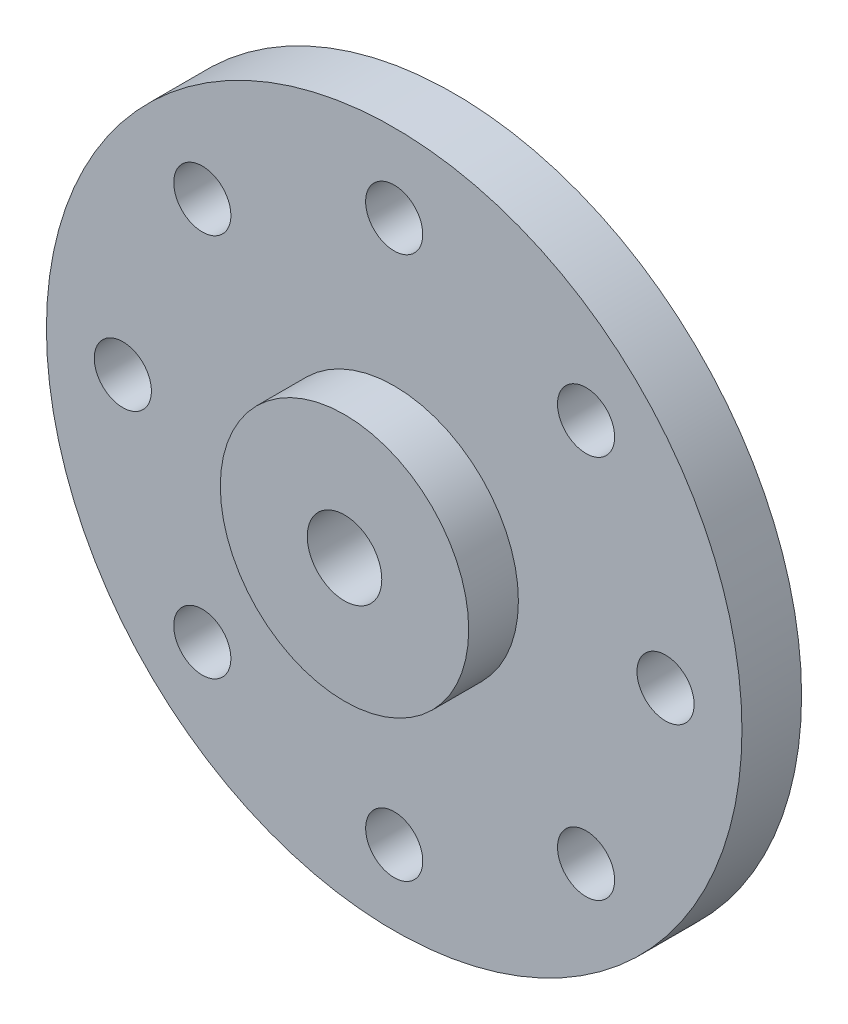
from build123d import *

# Parameters (mm, degrees)
SKETCH1_R           = 14
BOSS_EXTRUDE1_DEPTH = 2.4
SKETCH2_R           = 1.15
CUT_EXTRUDE1_DEPTH  = 20.94392138
CIRPATTERN2_COUNT   = 8
SKETCH4_R           = 5
BOSS_EXTRUDE2_DEPTH = 2
SKETCH5_R           = 1.5
CUT_EXTRUDE3_DEPTH  = 21.282011735


with BuildPart() as part:
    # Sketch1 → Boss-Extrude1 (new body)
    with BuildSketch(Plane.XY):
        Circle(SKETCH1_R)
    extrude(amount=BOSS_EXTRUDE1_DEPTH)

    # Sketch2 → Cut-Extrude1 (cut, through all)
    with BuildSketch(Plane.XY.offset(2.4)):
        with Locations((0, 10.85)):
            Circle(SKETCH2_R)
    cut_extrude1 = extrude(amount=-CUT_EXTRUDE1_DEPTH, mode=Mode.SUBTRACT)

    # CirPattern2: Cut-Extrude1 ×8 about axis
    cirpattern2_axis = Axis((0, -0.073707157, 0), (0, 0, 1))
    for i in range(1, CIRPATTERN2_COUNT):
        add(cut_extrude1.rotate(cirpattern2_axis, i * 360 / CIRPATTERN2_COUNT), mode=Mode.SUBTRACT)

    # Sketch4 → Boss-Extrude2 (add)
    with BuildSketch(Plane.XY.offset(2.4)):
        Circle(SKETCH4_R)
    extrude(amount=BOSS_EXTRUDE2_DEPTH)

    # Sketch5 → Cut-Extrude3 (cut, through all)
    with BuildSketch(Plane.XY.offset(4.4)):
        Circle(SKETCH5_R)
    extrude(amount=-CUT_EXTRUDE3_DEPTH, mode=Mode.SUBTRACT)


solid = part.part
